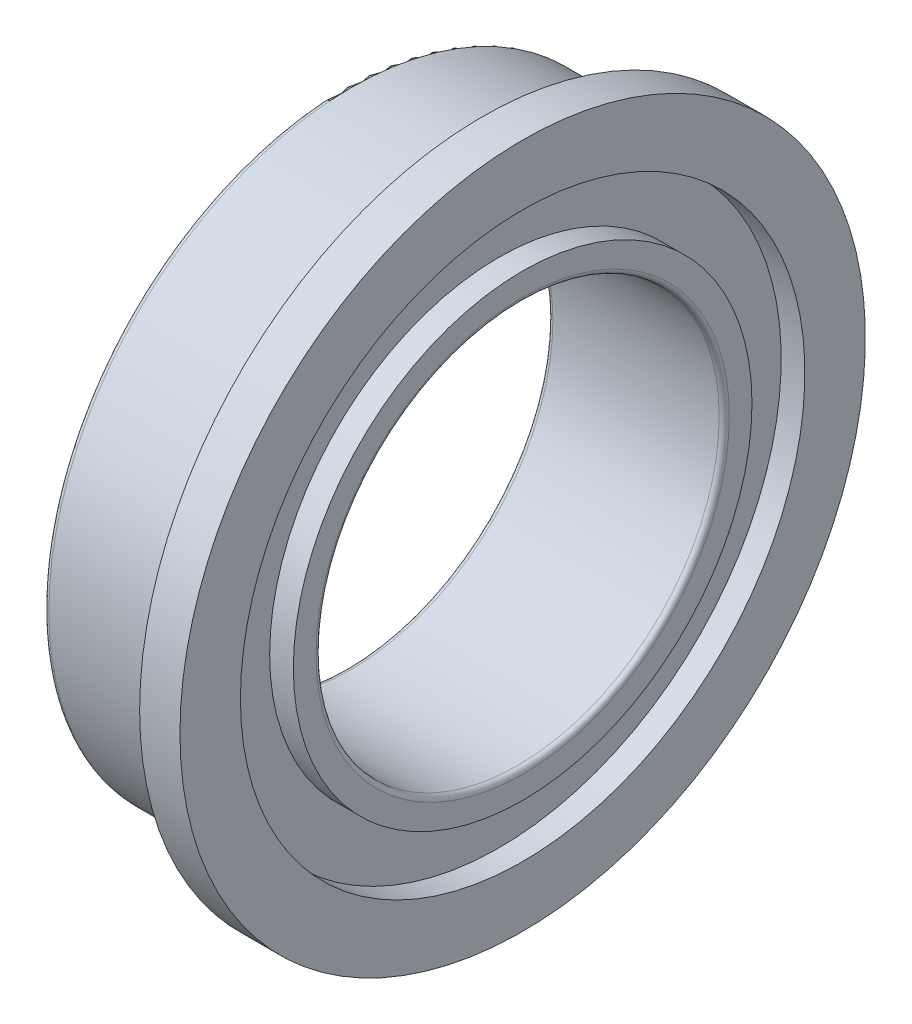
from build123d import *

# Parameters (mm, degrees)
FILLET1_R = 0.1


with BuildPart() as part:
    # Sketch1 → Revolve1 (revolve)
    with BuildSketch(Plane.XY, mode=Mode.PRIVATE) as revolve1_sk:
        with BuildLine():
            Line((0, 6.2), (0, 6.8))
            Line((0, 6.8), (0.8, 6.8))
            Line((0.8, 6.8), (0.8, 5.6))
            Line((0.8, 5.6), (0.33, 5.6))
            Line((0.33, 5.6), (0.33, 4.55))
            Line((0.33, 4.55), (0.8, 4.55))
            Line((0.8, 4.55), (0.8, 4))
            Line((0.8, 4), (-2.7, 4))
            Line((-2.7, 4), (-2.7, 4.55))
            Line((-2.7, 4.55), (-2.23, 4.55))
            Line((-2.23, 4.55), (-2.23, 5.6))
            Line((-2.23, 5.6), (-2.7, 5.6))
            Line((-2.7, 5.6), (-2.7, 6))
            Line((-2.7, 6), (-0.2, 6))
            ThreePointArc((-0.2, 6), (0.141421356, 5.858578644), (0, 6.2))
        make_face()
    revolve(revolve1_sk.sketch.rotate(Axis((-2.7, 0, 0), (1, 0, 0)), 90), axis=Axis((-2.7, 0, 0), (1, 0, 0)))

    # Fillet1
    fillet1_edges = [part.edges().sort_by_distance(p)[0] for p in [
        (0.8, 0, -4),
        (-2.7, 0, -4),
        (-2.7, 0, -6),
    ]]
    fillet(fillet1_edges, radius=FILLET1_R)


solid = part.part
